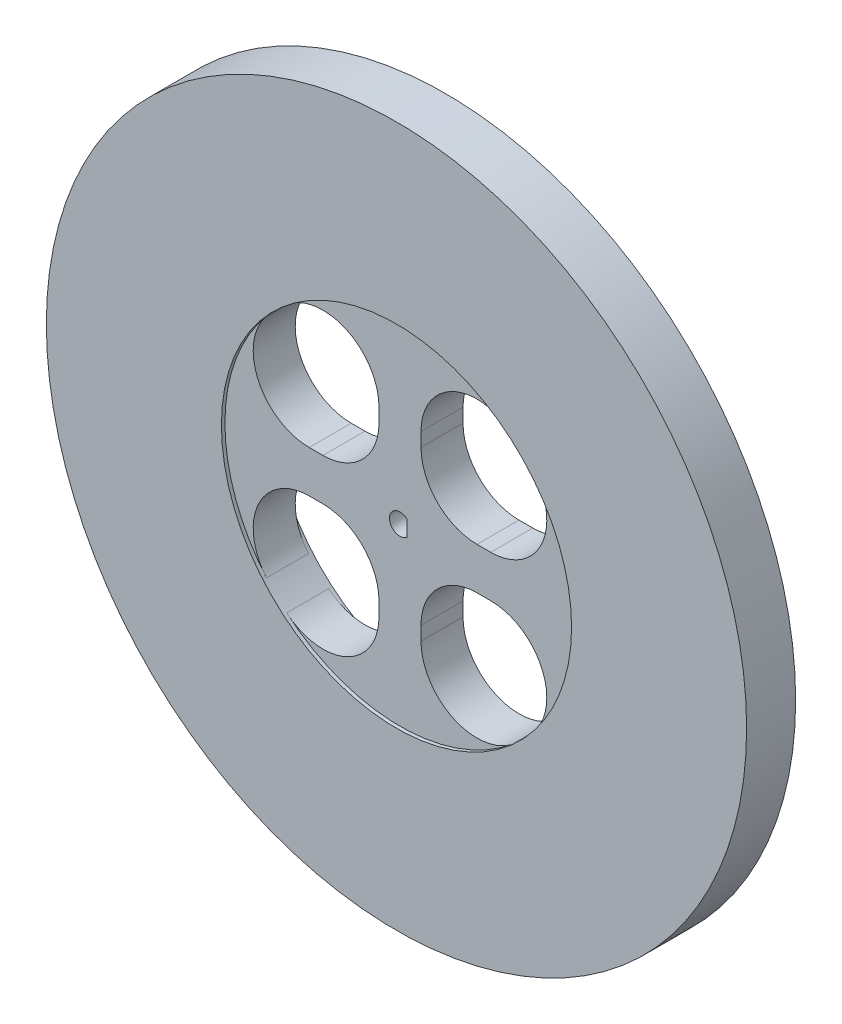
from build123d import *

# Parameters (mm, degrees)
SKETCH4_W                = 25
SKETCH4_H                = 7
BOSS_EXTRUDE3_DEPTH      = 3
BOSS_EXTRUDE3_DEPTH_BACK = 3
FILLET2_R                = 8
CUT_EXTRUDE1_REACH       = 73.009


with BuildPart() as part:
    # Sketch4 → Revolve2 (revolve)
    with BuildSketch(Plane(origin=(0, 0, 0), x_dir=(1, 0, 0), z_dir=(0, 1, 0)), mode=Mode.PRIVATE) as revolve2_sk:
        with Locations((37.5, 0)):
            Rectangle(SKETCH4_W, SKETCH4_H)
    revolve(revolve2_sk.sketch.rotate(Axis((0, 0, -11.674254949), (0, 0, 1)), 180), axis=Axis((0, 0, -11.674254949), (0, 0, 1)))

    # Sketch5 → Boss-Extrude3 (add, two sides: drawn at the far end of the back side and taken through both)
    with BuildSketch(Plane.XY.offset(-BOSS_EXTRUDE3_DEPTH_BACK)):
        with BuildLine():
            Line((-3, 24.819347292), (-3, 3))
            Line((-3, 3), (-24.819347292, 3))
            ThreePointArc((-24.819347292, 3), (-25, 0), (-24.819347292, -3))
            Line((-24.819347292, -3), (-3, -3))
            Line((-3, -3), (-3, -24.819347292))
            ThreePointArc((-3, -24.819347292), (0, -25), (3, -24.819347292))
            Line((3, -24.819347292), (3, -3))
            Line((3, -3), (24.819347292, -3))
            ThreePointArc((24.819347292, -3), (25, 0), (24.819347292, 3))
            Line((24.819347292, 3), (3, 3))
            Line((3, 3), (3, 24.819347292))
            ThreePointArc((3, 24.819347292), (0, 25), (-3, 24.819347292))
        make_face()
    extrude(amount=BOSS_EXTRUDE3_DEPTH + BOSS_EXTRUDE3_DEPTH_BACK)

    # Fillet2
    fillet2_edges = [part.edges().sort_by_distance(p)[0] for p in [
        (-3, 24.819347292, 0),
        (3, 24.819347292, 0),
        (3, 3, 0),
        (24.819347292, 3, 0),
        (24.819347292, -3, 0),
        (3, -3, 0),
        (3, -24.819347292, 0),
        (-3, -24.819347292, 0),
        (-3, -3, 0),
        (-24.819347292, -3, 0),
        (-24.819347292, 3, 0),
        (-3, 3, 0),
    ]]
    fillet(fillet2_edges, radius=FILLET2_R)

    # Sketch6 → Cut-Extrude1 (cut, up to next)
    with BuildSketch(Plane.XY.offset(3), mode=Mode.PRIVATE) as cut_extrude1_sk1:
        with BuildLine():
            Line((1, 1.118033989), (1, -1.118033989))
            ThreePointArc((1, -1.118033989), (-1.5, 0), (1, 1.118033989))
        make_face()
    cut_extrude1_tool1 = extrude(cut_extrude1_sk1.sketch, amount=-CUT_EXTRUDE1_REACH, mode=Mode.PRIVATE) & part.part
    add(cut_extrude1_tool1.solids().sort_by_distance((-0.148024, 0, 3))[0], mode=Mode.SUBTRACT)


solid = part.part
